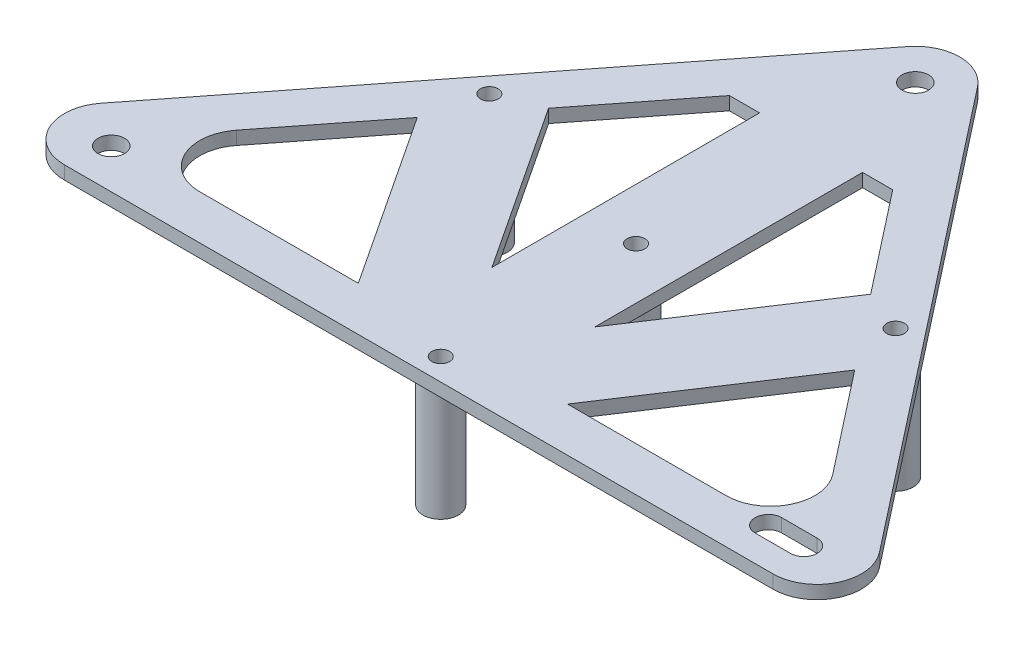
from build123d import *

# Parameters (mm, degrees)
SKETCH1_R           = 2
SKETCH1_R_2         = 3
BOSS_EXTRUDE1_DEPTH = 3
BOSS_EXTRUDE2_START = -26
SKETCH1_4_R         = 4
SKETCH1_4_R_2       = 2
BOSS_EXTRUDE2_DEPTH = 26


with BuildPart() as part:
    # Sketch1 → Boss-Extrude1 (new body)
    with BuildSketch(Plane(origin=(0, 0, 0), x_dir=(1, 0, 0), z_dir=(0, 1, 0))):
        with BuildLine():
            ThreePointArc((158.22466969, -8.975009298), (167.21501885, -3.353778756), (166.098002955, 7.190266308))
            Line((166.098002955, 7.190266308), (86.175088728, 109.255409789))
            ThreePointArc((86.175088728, 109.255409789), (78.301755463, 113.090134184), (70.428422197, 109.255409789))
            Line((70.428422197, 109.255409789), (-9.49449203, 7.190266308))
            ThreePointArc((-9.49449203, 7.190266308), (-10.611507924, -3.353778756), (-1.621158764, -8.975009298))
            Line((-1.621158764, -8.975009298), (78.301755463, -8.975009298))
            Line((78.301755463, -8.975009298), (158.22466969, -8.975009298))
        make_face()
        with Locations((78.301755463, 40.077672933)):
            Circle(SKETCH1_R, mode=Mode.SUBTRACT)
        Circle(SKETCH1_R_2, mode=Mode.SUBTRACT)
        with BuildLine():
            ThreePointArc((18.910520844, 1.024990702), (9.920171683, 6.646221244), (11.037187578, 17.190266308))
            Line((11.037187578, 17.190266308), (28.959351543, 40.077672933))
            Line((28.959351543, 40.077672933), (54.70682481, 1.024990702))
            Line((54.70682481, 1.024990702), (18.910520844, 1.024990702))
        make_face(mode=Mode.SUBTRACT)
        Polygon((59.887035288, 79.573711202), (66.6846286, 79.573711202), (66.6846286, 19.192418643), (41.964871323, 56.686304577), align=None, mode=Mode.SUBTRACT)
        with BuildLine():
            Line((156.244075902, -3), (148.244075902, -3))
            ThreePointArc((148.244075902, -3), (145.244075902, 0), (148.244075902, 3))
            Line((148.244075902, 3), (156.244075902, 3))
            ThreePointArc((156.244075902, 3), (159.244075902, 0), (156.244075902, -3))
        make_face(mode=Mode.SUBTRACT)
        with BuildLine():
            Line((137.692990082, 1.024990702), (101.896686116, 1.024990702))
            Line((101.896686116, 1.024990702), (127.644159383, 40.077672933))
            Line((127.644159383, 40.077672933), (145.566323348, 17.190266308))
            ThreePointArc((145.566323348, 17.190266308), (146.683339242, 6.646221244), (137.692990082, 1.024990702))
        make_face(mode=Mode.SUBTRACT)
        Polygon((114.638639603, 56.686304577), (89.918882326, 19.192418643), (89.918882326, 79.573711202), (96.716475638, 79.573711202), align=None, mode=Mode.SUBTRACT)
        with Locations((78.301755463, 103.090134184)):
            Circle(SKETCH1_R_2, mode=Mode.SUBTRACT)
        with Locations((78.301755463, -3.975009298)):
            Circle(SKETCH1_R, mode=Mode.SUBTRACT)
        with Locations((32.47996742, 52.815460811)):
            Circle(SKETCH1_R, mode=Mode.SUBTRACT)
        with Locations((124.123543506, 52.815460811)):
            Circle(SKETCH1_R, mode=Mode.SUBTRACT)
    extrude(amount=BOSS_EXTRUDE1_DEPTH)

    # Sketch1<4> → Boss-Extrude2 (add)
    # profile 1 of 4: a face of its own
    with BuildSketch(Plane(origin=(0, 0, 0), x_dir=(1, 0, 0), z_dir=(0, 1, 0)).offset(BOSS_EXTRUDE2_START)):
        with Locations((32.47996742, 52.815460811)):
            Circle(SKETCH1_4_R)
        with Locations((32.47996742, 52.815460811)):
            Circle(SKETCH1_4_R_2, mode=Mode.SUBTRACT)
    # profile 2 of 4: a face of its own
    with BuildSketch(Plane(origin=(0, 0, 0), x_dir=(1, 0, 0), z_dir=(0, 1, 0)).offset(BOSS_EXTRUDE2_START)):
        with Locations((124.123543506, 52.815460811)):
            Circle(SKETCH1_4_R)
        with Locations((124.123543506, 52.815460811)):
            Circle(SKETCH1_4_R_2, mode=Mode.SUBTRACT)
    # profile 3 of 4: a face of its own
    with BuildSketch(Plane(origin=(0, 0, 0), x_dir=(1, 0, 0), z_dir=(0, 1, 0)).offset(BOSS_EXTRUDE2_START)):
        with Locations((78.301755463, 40.077672933)):
            Circle(SKETCH1_4_R)
        with Locations((78.301755463, 40.077672933)):
            Circle(SKETCH1_4_R_2, mode=Mode.SUBTRACT)
    # profile 4 of 4: a face of its own
    with BuildSketch(Plane(origin=(0, 0, 0), x_dir=(1, 0, 0), z_dir=(0, 1, 0)).offset(BOSS_EXTRUDE2_START)):
        with Locations((78.301755463, -3.975009298)):
            Circle(SKETCH1_4_R)
        with Locations((78.301755463, -3.975009298)):
            Circle(SKETCH1_4_R_2, mode=Mode.SUBTRACT)
    extrude(amount=BOSS_EXTRUDE2_DEPTH)


solid = part.part
